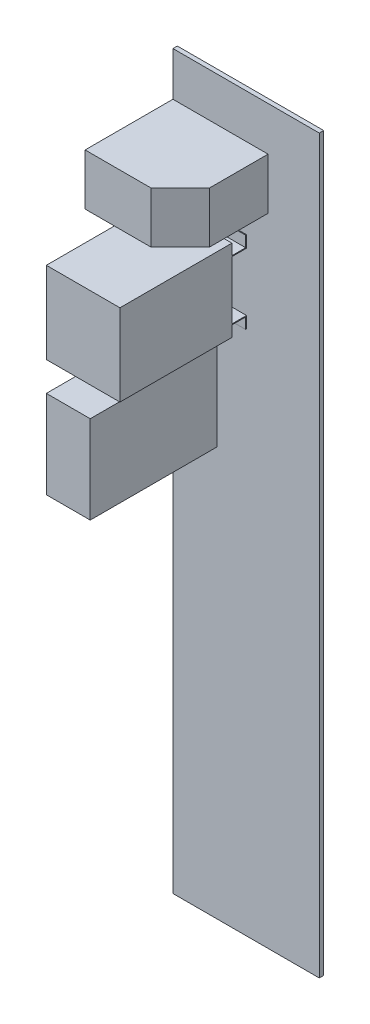
from build123d import *

# Parameters (mm, degrees)
SKETCH_1_W          = 503
SKETCH_1_H          = 558
EXTRUDE_1_DEPTH     = 865
SKETCH_2_W          = 200
SKETCH_2_H          = 398
CUT_EXTRUDE_1_DEPTH = 1039.785348376
SKETCH_3_W          = 94
SKETCH_3_H          = 148
CUT_EXTRUDE_2_DEPTH = 1039.785348376
SKETCH_4_W          = 300
SKETCH_4_H          = 600
EXTRUDE_2_DEPTH     = 865
SKETCH_5_W          = 650
SKETCH_5_H          = 350
EXTRUDE_3_DEPTH     = 600
CHAMFER_1_SIZE      = 200
SKETCH_6_W          = 1000
SKETCH_6_H          = 5000
EXTRUDE_4_DEPTH     = 30


with BuildPart() as part:
    # 草图1 → 凸台-拉伸1 (new body)
    with BuildSketch(Plane.XY):
        Rectangle(SKETCH_1_W, SKETCH_1_H)
    extrude(amount=EXTRUDE_1_DEPTH)

    # 草图2 → 切除-拉伸1 (cut, through all)
    with BuildSketch(Plane(origin=(251.5, 0, 0), x_dir=(0, 0, -1), z_dir=(1, 0, 0))):
        Rectangle(SKETCH_2_W, SKETCH_2_H)
    extrude(amount=-CUT_EXTRUDE_1_DEPTH, mode=Mode.SUBTRACT)

    # 草图3 → 切除-拉伸2 (cut, through all)
    with BuildSketch(Plane(origin=(251.5, 0, 0), x_dir=(0, 0, -1), z_dir=(1, 0, 0))):
        with Locations((-53, -279)):
            Rectangle(SKETCH_3_W, SKETCH_3_H)
    cut_extrude_2 = extrude(amount=-CUT_EXTRUDE_2_DEPTH, mode=Mode.SUBTRACT)

    # 镜向1: 切除-拉伸2 across plane
    add(cut_extrude_2.mirror(Plane.ZX), mode=Mode.SUBTRACT)


with BuildPart() as body_2:
    # 草图4 → 凸台-拉伸2 (new body)
    with BuildSketch(Plane(origin=(0, 0, 0), x_dir=(-1, 0, 0), z_dir=(0, 0, -1))):
        with Locations((101.5, -779)):
            Rectangle(SKETCH_4_W, SKETCH_4_H)
    extrude(amount=-EXTRUDE_2_DEPTH)


with BuildPart() as body_3:
    # 草图5 → 凸台-拉伸3 (new body)
    with BuildSketch(Plane(origin=(0, 0, 0), x_dir=(-1, 0, 0), z_dir=(0, 0, -1))):
        with Locations((-73.5, 654)):
            Rectangle(SKETCH_5_W, SKETCH_5_H)
    extrude(amount=-EXTRUDE_3_DEPTH)

    # 倒角1
    chamfer_1_edges = [body_3.edges().sort_by_distance(p)[0] for p in [
        (398.5, 654, 600),
    ]]
    chamfer(chamfer_1_edges, length=CHAMFER_1_SIZE)


with BuildPart() as body_4:
    # 草图6 → 凸台-拉伸4 (new body)
    with BuildSketch(Plane(origin=(0, 0, 0), x_dir=(-1, 0, 0), z_dir=(0, 0, -1))):
        with Locations((-248.5, -1371)):
            Rectangle(SKETCH_6_W, SKETCH_6_H)
    extrude(amount=EXTRUDE_4_DEPTH)


solid = Compound([part.part, body_2.part, body_3.part, body_4.part])
